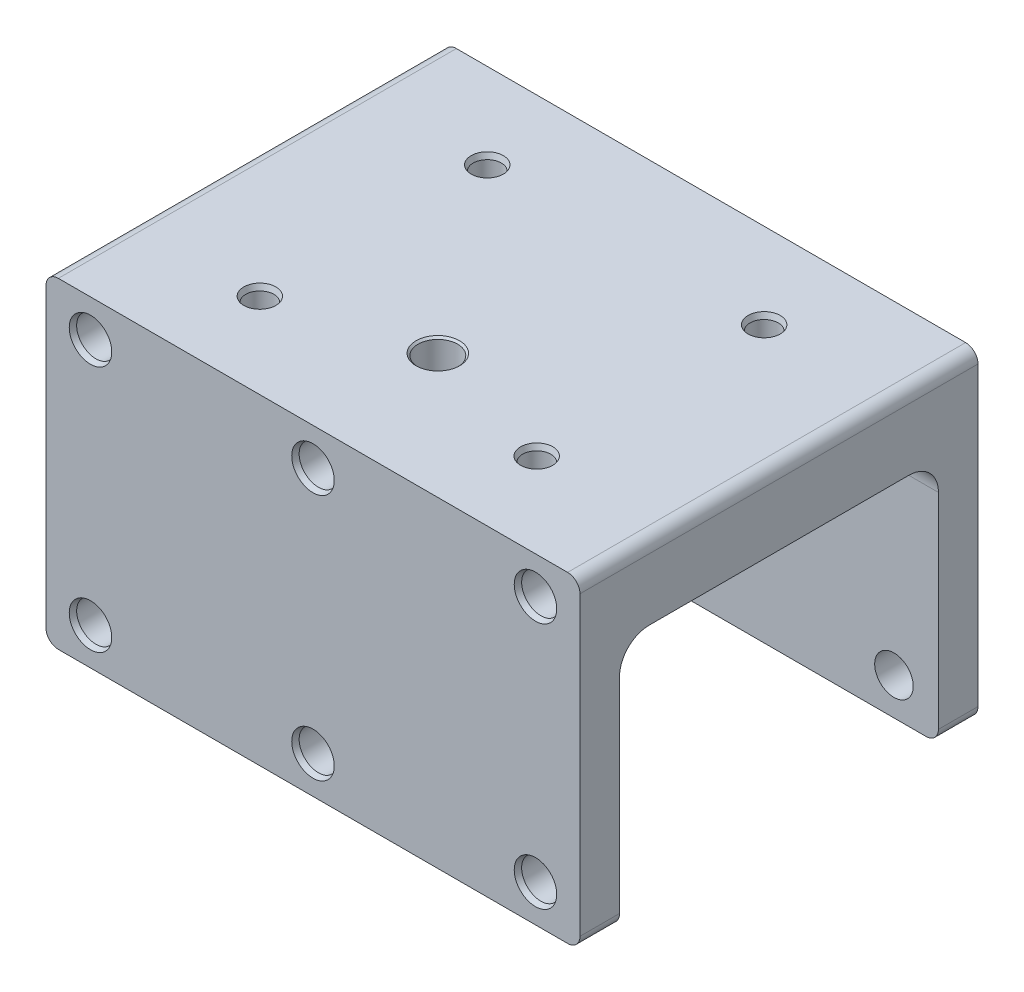
from build123d import *
from OCP.BRepFilletAPI import BRepFilletAPI_MakeChamfer

# Parameters (mm, degrees)
SKETCH1_W           = 108
SKETCH1_H           = 80.5
BOSS_EXTRUDE1_DEPTH = 15
SKETCH2_R           = 3.9
CUT_EXTRUDE1_DEPTH  = 7
SKETCH3_W           = 108
SKETCH3_H           = 50
SKETCH3_R           = 3.9
BOSS_EXTRUDE2_DEPTH = 8
CHAMFER1_SIZE       = 0.4
CHAMFER1_SIZE2      = 1.098990968
FILLET1_R           = 2.5
FILLET2_R           = 6
SKETCH4_R           = 2.85
CUT_EXTRUDE2_DEPTH  = 11
CHAMFER2_SIZE       = 0.4
CHAMFER2_SIZE2      = 1.098990968
SKETCH5_R           = 4
CUT_EXTRUDE3_DEPTH  = 150.563531651
CHAMFER3_SIZE       = 0.4


with BuildPart() as part:
    # Sketch1 → Boss-Extrude1 (new body)
    with BuildSketch(Plane(origin=(0, 0, 0), x_dir=(1, 0, 0), z_dir=(0, 1, 0))):
        with Locations((54, 40.25)):
            Rectangle(SKETCH1_W, SKETCH1_H)
    extrude(amount=BOSS_EXTRUDE1_DEPTH)

    # Sketch2 → Cut-Extrude1 (cut)
    with BuildSketch(Plane.XY):
        with Locations((9, 7.5)):
            Circle(SKETCH2_R)
        with Locations((99, 7.5)):
            Circle(SKETCH2_R)
        with Locations((54, 7.5)):
            Circle(SKETCH2_R)
    cut_extrude1 = extrude(amount=-CUT_EXTRUDE1_DEPTH, mode=Mode.SUBTRACT)

    # Sketch3 → Boss-Extrude2 (add)
    with BuildSketch(Plane.XY):
        with Locations((54, -25)):
            Rectangle(SKETCH3_W, SKETCH3_H)
        with Locations((99, -42.5)):
            Circle(SKETCH3_R, mode=Mode.SUBTRACT)
        with Locations((54, -42.5)):
            Circle(SKETCH3_R, mode=Mode.SUBTRACT)
        with Locations((9, -42.5)):
            Circle(SKETCH3_R, mode=Mode.SUBTRACT)
    boss_extrude2 = extrude(amount=-BOSS_EXTRUDE2_DEPTH)

    # Mirror1: Cut-Extrude1, Boss-Extrude2 across plane
    add(cut_extrude1.mirror(Plane.XY.offset(-40.25)), mode=Mode.SUBTRACT)
    add(boss_extrude2.mirror(Plane.XY.offset(-40.25)))

    # Chamfer1: one chamfer whose edges measure the first distance from different faces: ONE call of the kernel's chamfer builder (chamfer() names one face for all edges)
    chamfer1_edges_1 = [part.edges().sort_by_distance(p)[0] for p in [
        (5.1, 7.5, 0),
        (95.1, 7.5, 0),
        (50.1, 7.5, 0),
        (95.1, -42.5, 0),
        (50.1, -42.5, 0),
        (5.1, -42.5, 0),
    ]]
    chamfer1_side_1 = [part.faces().sort_by_distance(p)[0] for p in [
        (54, -17.5, 0),
    ]]
    chamfer1_edges_2 = [part.edges().sort_by_distance(p)[0] for p in [
        (5.1, 7.5, -80.5),
        (95.1, 7.5, -80.5),
        (50.1, 7.5, -80.5),
        (50.1, -42.5, -80.5),
        (95.1, -42.5, -80.5),
        (5.1, -42.5, -80.5),
    ]]
    chamfer1_side_2 = [part.faces().sort_by_distance(p)[0] for p in [
        (54, -17.5, -80.5),
    ]]
    chamfer1 = BRepFilletAPI_MakeChamfer(part.part.solid().wrapped)
    for e in chamfer1_edges_1:
        chamfer1.Add(CHAMFER1_SIZE, CHAMFER1_SIZE2, e.wrapped, chamfer1_side_1[0].wrapped)  # the first distance lies on this face
    for e in chamfer1_edges_2:
        chamfer1.Add(CHAMFER1_SIZE, CHAMFER1_SIZE2, e.wrapped, chamfer1_side_2[0].wrapped)  # the first distance lies on this face
    add(Compound.cast(chamfer1.Shape()), mode=Mode.REPLACE)

    # Fillet1
    fillet1_edges = [part.edges().sort_by_distance(p)[0] for p in [
        (108, 15, -40.25),
        (0, -50, -4),
        (108, -50, -4),
        (0, 15, -40.25),
        (0, -50, -76.5),
        (108, -50, -76.5),
    ]]
    fillet(fillet1_edges, radius=FILLET1_R)

    # Fillet2
    fillet2_edges = [part.edges().sort_by_distance(p)[0] for p in [
        (54, 0, -8),
        (54, 0, -72.5),
    ]]
    fillet(fillet2_edges, radius=FILLET2_R)

    # Sketch4 → Cut-Extrude2 (cut)
    with BuildSketch(Plane(origin=(0, 15, 0), x_dir=(1, 0, 0), z_dir=(0, 1, 0))):
        with Locations(Location((82, 17.25, 0), (0, 0, 270))):
            Circle(SKETCH4_R)
        with Locations(Location((26, 17.25, 0), (0, 0, 270))):
            Circle(SKETCH4_R)
        with Locations(Location((26, 63.25, 0), (0, 0, 270))):
            Circle(SKETCH4_R)
        with Locations(Location((82, 63.25, 0), (0, 0, 270))):
            Circle(SKETCH4_R)
    extrude(amount=-CUT_EXTRUDE2_DEPTH, mode=Mode.SUBTRACT)

    # Chamfer2
    chamfer2_edges = [part.edges().sort_by_distance(p)[0] for p in [
        (82, 15, -66.1),
        (26, 15, -66.1),
        (26, 15, -20.1),
        (82, 15, -20.1),
    ]]
    chamfer2_side = [part.faces().sort_by_distance(p)[0] for p in [
        (54, 15, -40.25),
    ]]
    chamfer(chamfer2_edges, length=CHAMFER2_SIZE, length2=CHAMFER2_SIZE2, reference=chamfer2_side[0])

    # Sketch5 → Cut-Extrude3 (cut, through all)
    with BuildSketch(Plane(origin=(0, 15, 0), x_dir=(1, 0, 0), z_dir=(0, 1, 0))):
        with Locations(Location((54, 25.25, 0), (0, 0, 270))):
            Circle(SKETCH5_R)
    extrude(amount=-CUT_EXTRUDE3_DEPTH, mode=Mode.SUBTRACT)

    # Chamfer3
    chamfer3_edges = [part.edges().sort_by_distance(p)[0] for p in [
        (54, 15, -29.25),
    ]]
    chamfer(chamfer3_edges, length=CHAMFER3_SIZE)


solid = part.part
